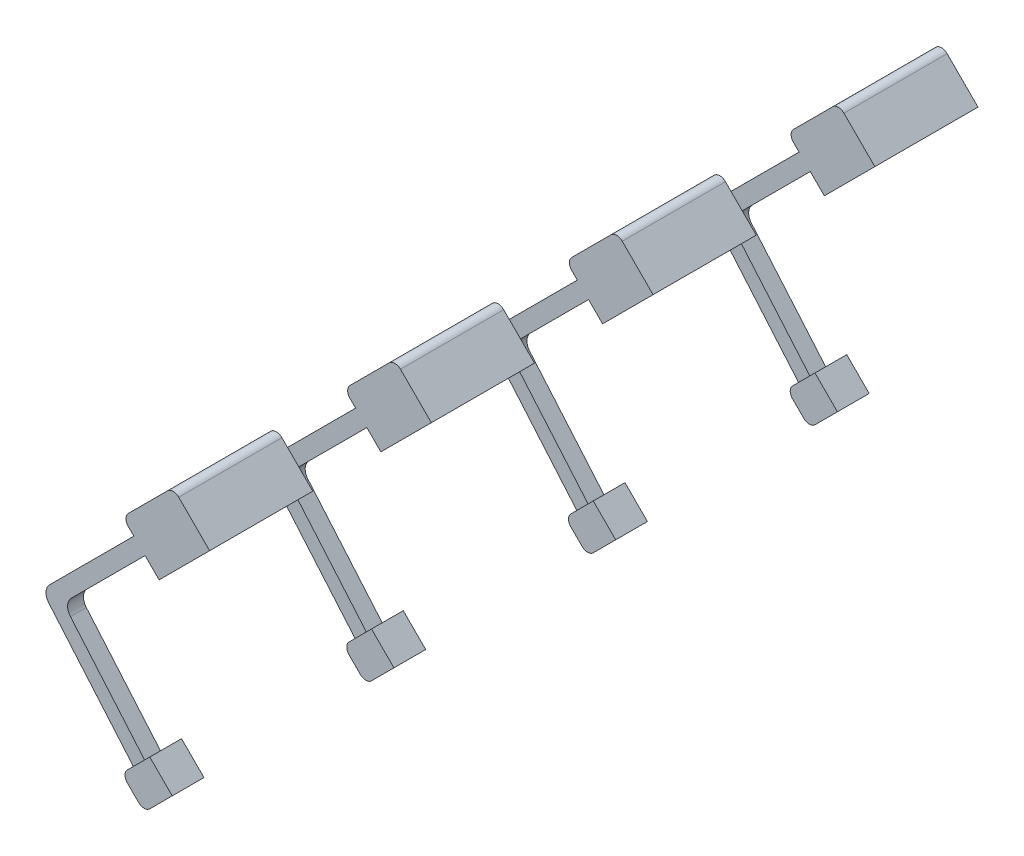
from build123d import *

# Parameters (mm, degrees)
COIL_START        = -27.9
COIL_2_DEPTH      = 52
PLUG_START        = 16.1
PLUG_LEAD_2_DEPTH = 8
PLUG_START_2      = 12.1
PLUG_BOOT_2_DEPTH = 16
COIL_START_2      = -139.66
COIL_4_DEPTH      = 52
PLUG_START_3      = -95.66
PLUG_LEAD_4_DEPTH = 8
PLUG_START_4      = -99.66
PLUG_BOOT_4_DEPTH = 16
COIL_START_3      = -251.42
COIL_6_DEPTH      = 52
PLUG_START_5      = -207.42
PLUG_LEAD_6_DEPTH = 8
PLUG_START_6      = -211.42
PLUG_BOOT_6_DEPTH = 16
COIL_START_4      = -363.18
COIL_8_DEPTH      = 52
PLUG_START_7      = -319.18
PLUG_LEAD_8_DEPTH = 8
PLUG_START_8      = -323.18
PLUG_BOOT_8_DEPTH = 16


with BuildPart() as part:
    # Sketch1 → Coil 2 (new body)
    with BuildSketch(Plane.XY.offset(COIL_START)):
        with BuildLine():
            Line((-261.5941537, 287.049997823), (-287.049997823, 261.5941537))
            Line((-287.049997823, 261.5941537), (-302.606347009, 277.150502886))
            ThreePointArc((-302.606347009, 277.150502886), (-303.777919884, 279.978930011), (-302.606347009, 282.807357136))
            Line((-302.606347009, 282.807357136), (-282.807357136, 302.606347009))
            ThreePointArc((-282.807357136, 302.606347009), (-279.978930011, 303.777919884), (-277.150502886, 302.606347009))
            Line((-277.150502886, 302.606347009), (-261.5941537, 287.049997823))
        make_face()
    extrude(amount=COIL_2_DEPTH)

    # Sketch2 → Plug Lead 2 (add)
    with BuildSketch(Plane.XY.offset(PLUG_START)):
        with BuildLine():
            Line((-288.464211385, 274.322075761), (-331.433712353, 231.352574794))
            ThreePointArc((-331.433712353, 231.352574794), (-333.18629268, 227.349360476), (-331.758531048, 223.219135373))
            Line((-331.758531048, 223.219135373), (-288.954772369, 172.971244749))
            Line((-288.954772369, 172.971244749), (-295.044718213, 167.783513104))
            Line((-295.044718213, 167.783513104), (-342.63776427, 223.65361065))
            ThreePointArc((-342.63776427, 223.65361065), (-344.065525902, 227.783835753), (-342.312945575, 231.787050071))
            Line((-342.312945575, 231.787050071), (-294.121065635, 279.978930011))
            Line((-294.121065635, 279.978930011), (-288.464211385, 274.322075761))
        make_face()
    extrude(amount=PLUG_LEAD_2_DEPTH)

    # Sketch3 → Plug Boot 2 (add)
    with BuildSketch(Plane.XY.offset(PLUG_START_2)):
        with BuildLine():
            Line((-276.443396105, 174.620019614), (-287.757104604, 163.306311115))
            ThreePointArc((-287.757104604, 163.306311115), (-290.585531729, 162.13473824), (-293.413958853, 163.306311115))
            Line((-293.413958853, 163.306311115), (-299.070813103, 168.963165365))
            ThreePointArc((-299.070813103, 168.963165365), (-300.242385978, 171.791592489), (-299.070813103, 174.620019614))
            Line((-299.070813103, 174.620019614), (-287.757104604, 185.933728113))
            Line((-287.757104604, 185.933728113), (-276.443396105, 174.620019614))
        make_face()
    extrude(amount=PLUG_BOOT_2_DEPTH)


with BuildPart() as body_2:
    # Sketch4 → Coil 4 (new body)
    with BuildSketch(Plane.XY.offset(COIL_START_2)):
        with BuildLine():
            Line((-261.5941537, 287.049997823), (-287.049997823, 261.5941537))
            Line((-287.049997823, 261.5941537), (-302.606347009, 277.150502886))
            ThreePointArc((-302.606347009, 277.150502886), (-303.777919884, 279.978930011), (-302.606347009, 282.807357136))
            Line((-302.606347009, 282.807357136), (-282.807357136, 302.606347009))
            ThreePointArc((-282.807357136, 302.606347009), (-279.978930011, 303.777919884), (-277.150502886, 302.606347009))
            Line((-277.150502886, 302.606347009), (-261.5941537, 287.049997823))
        make_face()
    extrude(amount=COIL_4_DEPTH)

    # Sketch5 → Plug Lead 4 (add)
    with BuildSketch(Plane.XY.offset(PLUG_START_3)):
        with BuildLine():
            Line((-288.464211385, 274.322075761), (-331.433712353, 231.352574794))
            ThreePointArc((-331.433712353, 231.352574794), (-333.18629268, 227.349360476), (-331.758531048, 223.219135373))
            Line((-331.758531048, 223.219135373), (-288.954772369, 172.971244749))
            Line((-288.954772369, 172.971244749), (-295.044718213, 167.783513104))
            Line((-295.044718213, 167.783513104), (-342.63776427, 223.65361065))
            ThreePointArc((-342.63776427, 223.65361065), (-344.065525902, 227.783835753), (-342.312945575, 231.787050071))
            Line((-342.312945575, 231.787050071), (-294.121065635, 279.978930011))
            Line((-294.121065635, 279.978930011), (-288.464211385, 274.322075761))
        make_face()
    extrude(amount=PLUG_LEAD_4_DEPTH)

    # Sketch6 → Plug Boot 4 (add)
    with BuildSketch(Plane.XY.offset(PLUG_START_4)):
        with BuildLine():
            Line((-276.443396105, 174.620019614), (-287.757104604, 163.306311115))
            ThreePointArc((-287.757104604, 163.306311115), (-290.585531729, 162.13473824), (-293.413958853, 163.306311115))
            Line((-293.413958853, 163.306311115), (-299.070813103, 168.963165365))
            ThreePointArc((-299.070813103, 168.963165365), (-300.242385978, 171.791592489), (-299.070813103, 174.620019614))
            Line((-299.070813103, 174.620019614), (-287.757104604, 185.933728113))
            Line((-287.757104604, 185.933728113), (-276.443396105, 174.620019614))
        make_face()
    extrude(amount=PLUG_BOOT_4_DEPTH)


with BuildPart() as body_3:
    # Sketch7 → Coil 6 (new body)
    with BuildSketch(Plane.XY.offset(COIL_START_3)):
        with BuildLine():
            Line((-261.5941537, 287.049997823), (-287.049997823, 261.5941537))
            Line((-287.049997823, 261.5941537), (-302.606347009, 277.150502886))
            ThreePointArc((-302.606347009, 277.150502886), (-303.777919884, 279.978930011), (-302.606347009, 282.807357136))
            Line((-302.606347009, 282.807357136), (-282.807357136, 302.606347009))
            ThreePointArc((-282.807357136, 302.606347009), (-279.978930011, 303.777919884), (-277.150502886, 302.606347009))
            Line((-277.150502886, 302.606347009), (-261.5941537, 287.049997823))
        make_face()
    extrude(amount=COIL_6_DEPTH)

    # Sketch8 → Plug Lead 6 (add)
    with BuildSketch(Plane.XY.offset(PLUG_START_5)):
        with BuildLine():
            Line((-288.464211385, 274.322075761), (-331.433712353, 231.352574794))
            ThreePointArc((-331.433712353, 231.352574794), (-333.18629268, 227.349360476), (-331.758531048, 223.219135373))
            Line((-331.758531048, 223.219135373), (-288.954772369, 172.971244749))
            Line((-288.954772369, 172.971244749), (-295.044718213, 167.783513104))
            Line((-295.044718213, 167.783513104), (-342.63776427, 223.65361065))
            ThreePointArc((-342.63776427, 223.65361065), (-344.065525902, 227.783835753), (-342.312945575, 231.787050071))
            Line((-342.312945575, 231.787050071), (-294.121065635, 279.978930011))
            Line((-294.121065635, 279.978930011), (-288.464211385, 274.322075761))
        make_face()
    extrude(amount=PLUG_LEAD_6_DEPTH)

    # Sketch9 → Plug Boot 6 (add)
    with BuildSketch(Plane.XY.offset(PLUG_START_6)):
        with BuildLine():
            Line((-276.443396105, 174.620019614), (-287.757104604, 163.306311115))
            ThreePointArc((-287.757104604, 163.306311115), (-290.585531729, 162.13473824), (-293.413958853, 163.306311115))
            Line((-293.413958853, 163.306311115), (-299.070813103, 168.963165365))
            ThreePointArc((-299.070813103, 168.963165365), (-300.242385978, 171.791592489), (-299.070813103, 174.620019614))
            Line((-299.070813103, 174.620019614), (-287.757104604, 185.933728113))
            Line((-287.757104604, 185.933728113), (-276.443396105, 174.620019614))
        make_face()
    extrude(amount=PLUG_BOOT_6_DEPTH)


with BuildPart() as body_4:
    # Sketch10 → Coil 8 (new body)
    with BuildSketch(Plane.XY.offset(COIL_START_4)):
        with BuildLine():
            Line((-261.5941537, 287.049997823), (-287.049997823, 261.5941537))
            Line((-287.049997823, 261.5941537), (-302.606347009, 277.150502886))
            ThreePointArc((-302.606347009, 277.150502886), (-303.777919884, 279.978930011), (-302.606347009, 282.807357136))
            Line((-302.606347009, 282.807357136), (-282.807357136, 302.606347009))
            ThreePointArc((-282.807357136, 302.606347009), (-279.978930011, 303.777919884), (-277.150502886, 302.606347009))
            Line((-277.150502886, 302.606347009), (-261.5941537, 287.049997823))
        make_face()
    extrude(amount=COIL_8_DEPTH)

    # Sketch11 → Plug Lead 8 (add)
    with BuildSketch(Plane.XY.offset(PLUG_START_7)):
        with BuildLine():
            Line((-288.464211385, 274.322075761), (-331.433712353, 231.352574794))
            ThreePointArc((-331.433712353, 231.352574794), (-333.18629268, 227.349360476), (-331.758531048, 223.219135373))
            Line((-331.758531048, 223.219135373), (-288.954772369, 172.971244749))
            Line((-288.954772369, 172.971244749), (-295.044718213, 167.783513104))
            Line((-295.044718213, 167.783513104), (-342.63776427, 223.65361065))
            ThreePointArc((-342.63776427, 223.65361065), (-344.065525902, 227.783835753), (-342.312945575, 231.787050071))
            Line((-342.312945575, 231.787050071), (-294.121065635, 279.978930011))
            Line((-294.121065635, 279.978930011), (-288.464211385, 274.322075761))
        make_face()
    extrude(amount=PLUG_LEAD_8_DEPTH)

    # Sketch12 → Plug Boot 8 (add)
    with BuildSketch(Plane.XY.offset(PLUG_START_8)):
        with BuildLine():
            Line((-276.443396105, 174.620019614), (-287.757104604, 163.306311115))
            ThreePointArc((-287.757104604, 163.306311115), (-290.585531729, 162.13473824), (-293.413958853, 163.306311115))
            Line((-293.413958853, 163.306311115), (-299.070813103, 168.963165365))
            ThreePointArc((-299.070813103, 168.963165365), (-300.242385978, 171.791592489), (-299.070813103, 174.620019614))
            Line((-299.070813103, 174.620019614), (-287.757104604, 185.933728113))
            Line((-287.757104604, 185.933728113), (-276.443396105, 174.620019614))
        make_face()
    extrude(amount=PLUG_BOOT_8_DEPTH)


solid = Compound([part.part, body_2.part, body_3.part, body_4.part])
